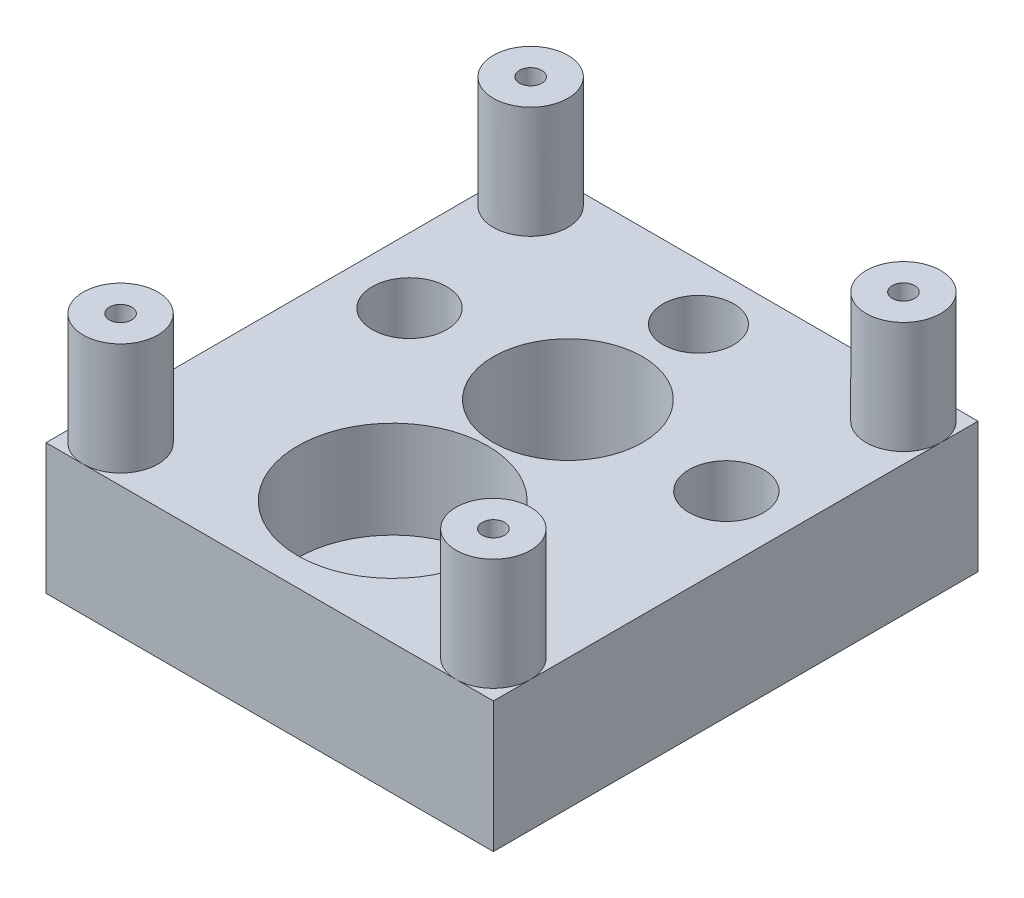
from build123d import *

# Parameters (mm, degrees)
SKETCH_1_W          = 12
SKETCH_1_H          = 13
SKETCH_1_R          = 2
SKETCH_1_R_2        = 0.8
SKETCH_1_R_3        = 0.7
EXTRUDE_1_DEPTH     = 3.5
CUT_EXTRUDE_START   = 3.5
SKETCH_1_3_R        = 1
SKETCH_1_3_R_2      = 0.95
CUT_EXTRUDE_2_DEPTH = 1.5
SKETCH_2_R          = 2.55
CUT_EXTRUDE_5_DEPTH = 2.6
SKETCH_3_R          = 1
EXTRUDE_2_DEPTH     = 3
CUT_EXTRUDE_START_2 = 3
SKETCH_3_3_R        = 0.3
CUT_EXTRUDE_6_DEPTH = 2


with BuildPart() as part:
    # 草图1 → 凸台-拉伸1 (new body)
    with BuildSketch(Plane(origin=(0, 0, 0), x_dir=(1, 0, 0), z_dir=(0, 1, 0))):
        with Locations((0, -1.5)):
            Rectangle(SKETCH_1_W, SKETCH_1_H)
        with Locations(Location((0, 0, 0), (0, 0, 270))):
            Circle(SKETCH_1_R, mode=Mode.SUBTRACT)
        with Locations(Location((-4.25, 0, 0), (0, 0, 270))):
            Circle(SKETCH_1_R_2, mode=Mode.SUBTRACT)
        with Locations(Location((4.25, 0, 0), (0, 0, 270))):
            Circle(SKETCH_1_R_2, mode=Mode.SUBTRACT)
        with Locations(Location((0, 3.5, 0), (0, 0, 270))):
            Circle(SKETCH_1_R_3, mode=Mode.SUBTRACT)
    extrude(amount=EXTRUDE_1_DEPTH)

    # 草图1<3> → 切除-拉伸2 (cut)
    with BuildSketch(Plane(origin=(0, 0, 0), x_dir=(1, 0, 0), z_dir=(0, 1, 0)).offset(CUT_EXTRUDE_START)):
        with Locations(Location((-4.25, 0, 0), (0, 0, 270))):
            Circle(SKETCH_1_3_R)
        with Locations(Location((4.25, 0, 0), (0, 0, 270))):
            Circle(SKETCH_1_3_R)
        with Locations(Location((0, 3.5, 0), (0, 0, 270))):
            Circle(SKETCH_1_3_R_2)
    extrude(amount=-CUT_EXTRUDE_2_DEPTH, mode=Mode.SUBTRACT)

    # 草图2 → 切除-拉伸5 (cut)
    with BuildSketch(Plane(origin=(0, 3.5, 0), x_dir=(1, 0, 0), z_dir=(0, 1, 0))):
        with Locations(Location((0, -4.7, 0), (0, 0, 270))):
            Circle(SKETCH_2_R)
    extrude(amount=-CUT_EXTRUDE_5_DEPTH, mode=Mode.SUBTRACT)

    # 草图3 → 凸台-拉伸2 (add)
    with BuildSketch(Plane(origin=(0, 3.5, 0), x_dir=(1, 0, 0), z_dir=(0, 1, 0))):
        with Locations(Location((-5, -7, 0), (0, 0, 270))):
            Circle(SKETCH_3_R)
        with Locations(Location((5, 4, 0), (0, 0, 90))):
            Circle(SKETCH_3_R)
        with Locations(Location((-5, 4, 0), (0, 0, 90))):
            Circle(SKETCH_3_R)
        with Locations(Location((5, -7, 0), (0, 0, 270))):
            Circle(SKETCH_3_R)
    extrude(amount=EXTRUDE_2_DEPTH)

    # 草图3<3> → 切除-拉伸6 (cut)
    with BuildSketch(Plane(origin=(0, 3.5, 0), x_dir=(1, 0, 0), z_dir=(0, 1, 0)).offset(CUT_EXTRUDE_START_2)):
        with Locations(Location((5, 4, 0), (0, 0, 270))):
            Circle(SKETCH_3_3_R)
        with Locations(Location((-5, -7, 0), (0, 0, 270))):
            Circle(SKETCH_3_3_R)
        with Locations(Location((-5, 4, 0), (0, 0, 270))):
            Circle(SKETCH_3_3_R)
        with Locations(Location((5, -7, 0), (0, 0, 270))):
            Circle(SKETCH_3_3_R)
    extrude(amount=-CUT_EXTRUDE_6_DEPTH, mode=Mode.SUBTRACT)


solid = part.part
